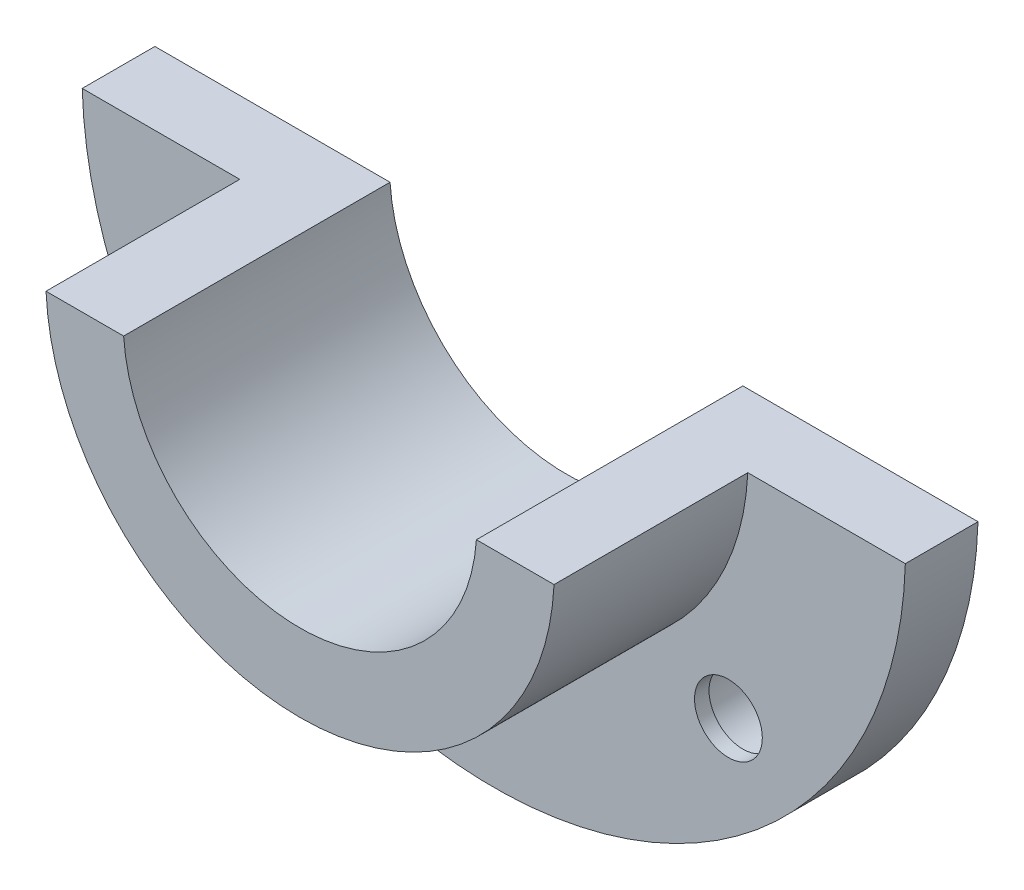
from build123d import *

# Parameters (mm, degrees)
SKETCH1_R               = 85
BOSS_EXTRUDE1_DEPTH     = 15
SKETCH2_R               = 52.5
BOSS_EXTRUDE2_DEPTH     = 40
CUT_EXTRUDE1_DEPTH      = 133.193040664
CUT_EXTRUDE1_DEPTH_BACK = 133.193040664
SKETCH3_R               = 36.5
CUT_EXTRUDE2_DEPTH      = 133.193040664
CUT_EXTRUDE2_DEPTH_BACK = 133.193040664
SKETCH4_W               = 179.422325272
SKETCH4_H               = 89.951571234
CUT_EXTRUDE3_DEPTH      = 133.193040664
CUT_EXTRUDE3_DEPTH_BACK = 133.193040664
SKETCH5_W               = 208.750471757
SKETCH5_H               = 2.5
CUT_EXTRUDE4_DEPTH      = 127.663925409
CUT_EXTRUDE4_DEPTH_BACK = 127.663925409
SKETCH6_R               = 7
SKETCH8_R               = 9
CUT_EXTRUDE5_DEPTH      = 12


with BuildPart() as part:
    # Sketch1 → Boss-Extrude1 (new body)
    with BuildSketch(Plane.XY):
        Circle(SKETCH1_R)
    extrude(amount=BOSS_EXTRUDE1_DEPTH)

    # Sketch2 → Boss-Extrude2 (add)
    with BuildSketch(Plane.XY.offset(15)):
        Circle(SKETCH2_R)
    extrude(amount=BOSS_EXTRUDE2_DEPTH)

    # Sketch3 → Cut-Extrude1 (cut, two sides: drawn at the far end of the back side and taken through both)
    with BuildSketch(Plane.XY.offset(55).offset(-CUT_EXTRUDE1_DEPTH_BACK)):
        Circle(SKETCH3_R)
    extrude(amount=CUT_EXTRUDE1_DEPTH + CUT_EXTRUDE1_DEPTH_BACK, mode=Mode.SUBTRACT)

    # Sketch4 → Cut-Extrude2 (cut, two sides: drawn at the far end of the back side and taken through both)
    with BuildSketch(Plane.XY.offset(55).offset(-CUT_EXTRUDE2_DEPTH_BACK)):
        with Locations((-4.711162636, 44.975785617)):
            Rectangle(SKETCH4_W, SKETCH4_H)
    extrude(amount=CUT_EXTRUDE2_DEPTH + CUT_EXTRUDE2_DEPTH_BACK, mode=Mode.SUBTRACT)

    # Sketch5 → Cut-Extrude3 (cut, two sides: drawn at the far end of the back side and taken through both)
    with BuildSketch(Plane.XY.offset(55).offset(-CUT_EXTRUDE3_DEPTH_BACK)):
        with Locations((-19.375235879, -1.25)):
            Rectangle(SKETCH5_W, SKETCH5_H)
    extrude(amount=CUT_EXTRUDE3_DEPTH + CUT_EXTRUDE3_DEPTH_BACK, mode=Mode.SUBTRACT)

    # Sketch6 → Cut-Extrude4 (cut, two sides: drawn at the far end of the back side and taken through both)
    with BuildSketch(Plane.XY.offset(15).offset(-CUT_EXTRUDE4_DEPTH_BACK)):
        with Locations((48.436814511, -48.436814511)):
            Circle(SKETCH6_R)
        with Locations((-48.436814511, -48.436814511)):
            Circle(SKETCH6_R)
    extrude(amount=CUT_EXTRUDE4_DEPTH + CUT_EXTRUDE4_DEPTH_BACK, mode=Mode.SUBTRACT)

    # Sketch8 → Cut-Extrude5 (cut)
    with BuildSketch(Plane(origin=(0, 0, 0), x_dir=(-1, 0, 0), z_dir=(0, 0, -1))):
        with Locations((-48.436814511, -48.436814511)):
            Circle(SKETCH8_R)
        with Locations((48.436814511, -48.436814511)):
            Circle(SKETCH8_R)
    extrude(amount=-CUT_EXTRUDE5_DEPTH, mode=Mode.SUBTRACT)


solid = part.part
